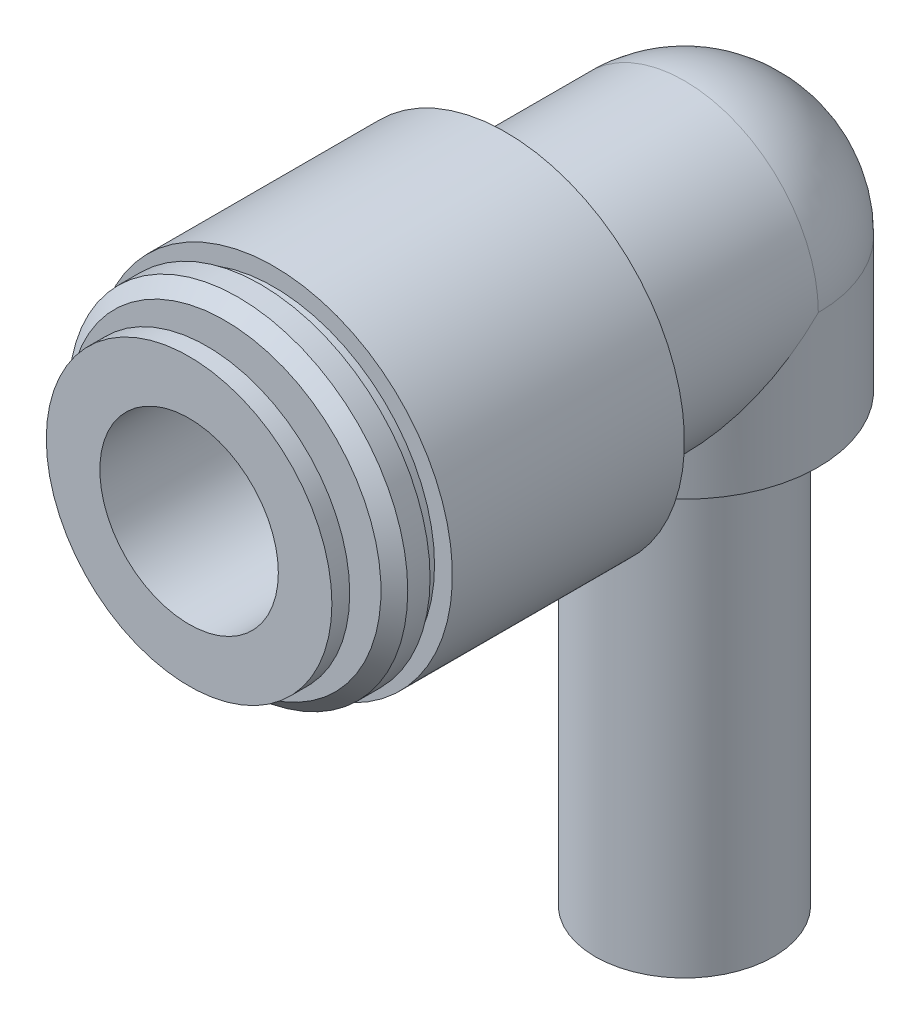
from build123d import *
from build123d.topology import SkipClean

# Parameters (mm, degrees)
SKETCH_1_R          = 5
SKETCH_1_R_2        = 4
EXTRUDE_1_DEPTH     = 25
SKETCH_3_R          = 7.5
EXTRUDE_2_DEPTH     = 10
SKETCH_4_R          = 10
EXTRUDE_3_DEPTH     = 13
SKETCH_6_R          = 5
CUT_EXTRUDE_1_DEPTH = 28


with BuildPart() as part:
    # Эскиз1 → Бобышка-Вытянуть1 (new body)
    with BuildSketch(Plane(origin=(0, 0, 0), x_dir=(1, 0, 0), z_dir=(0, 1, 0))):
        with Locations(Location((0, 0, 0), (0, 0, 270))):
            Circle(SKETCH_1_R)
        with Locations(Location((0, 0, 0), (0, 0, 270))):
            Circle(SKETCH_1_R_2, mode=Mode.SUBTRACT)
    extrude(amount=EXTRUDE_1_DEPTH)

    # Эскиз2 → Повернуть1 (revolve)
    with BuildSketch(Plane.XY, mode=Mode.PRIVATE) as revolve_1_sk:
        with BuildLine():
            Line((0, 25), (0, 40))
            ThreePointArc((0, 40), (5.303300859, 37.803300859), (7.5, 32.5))
            Line((7.5, 32.5), (7.5, 25))
            Line((7.5, 25), (0, 25))
        make_face()
    revolve(revolve_1_sk.sketch.rotate(Axis((0, 25, 0), (0, 1, 0)), 90), axis=Axis((0, 25, 0), (0, 1, 0)))

    # Эскиз3 → Бобышка-Вытянуть2 (add)
    with SkipClean():  # the faces are left unmerged after this step: merging them gives an invalid solid
        with BuildSketch(Plane.XY):
            with Locations((0, 32.5)):
                Circle(SKETCH_3_R)
        extrude(amount=EXTRUDE_2_DEPTH)

    # Эскиз4 → Бобышка-Вытянуть3 (add)
    with SkipClean():  # the faces are left unmerged after this step: merging them gives an invalid solid
        with BuildSketch(Plane.XY.offset(10)):
            with Locations(Location((0, 32.5, 0), (0, 0, 180))):
                Circle(SKETCH_4_R)
        extrude(amount=EXTRUDE_3_DEPTH)

    # Эскиз5 → Повернуть3 (revolve)
    with SkipClean():  # the faces are left unmerged after this step: merging them gives an invalid solid
        with BuildSketch(Plane(origin=(0, 0, 0), x_dir=(0, 0, -1), z_dir=(1, 0, 0)), mode=Mode.PRIVATE) as revolve_3_sk:
            Polygon((-26.75, 24.5), (-26.75, 26.5), (-25.75, 26.5), (-25.75, 23.75), (-25, 23), (-23.75, 23), (-23.75, 23.5), (-23, 23.5), (-23, 28.5), (-27.75, 28.5), (-27.75, 24.5), align=None)
        revolve(revolve_3_sk.sketch.rotate(Axis((0, 32.5, 23), (0, 0, 1)), 270), axis=Axis((0, 32.5, 23), (0, 0, 1)))

    # Эскиз6 → Вырез-Вытянуть1 (cut)
    with SkipClean():  # the faces are left unmerged after this step: merging them gives an invalid solid
        with BuildSketch(Plane.XY.offset(27.75)):
            with Locations((0, 32.5)):
                Circle(SKETCH_6_R)
        extrude(amount=-CUT_EXTRUDE_1_DEPTH, mode=Mode.SUBTRACT)


solid = part.part
